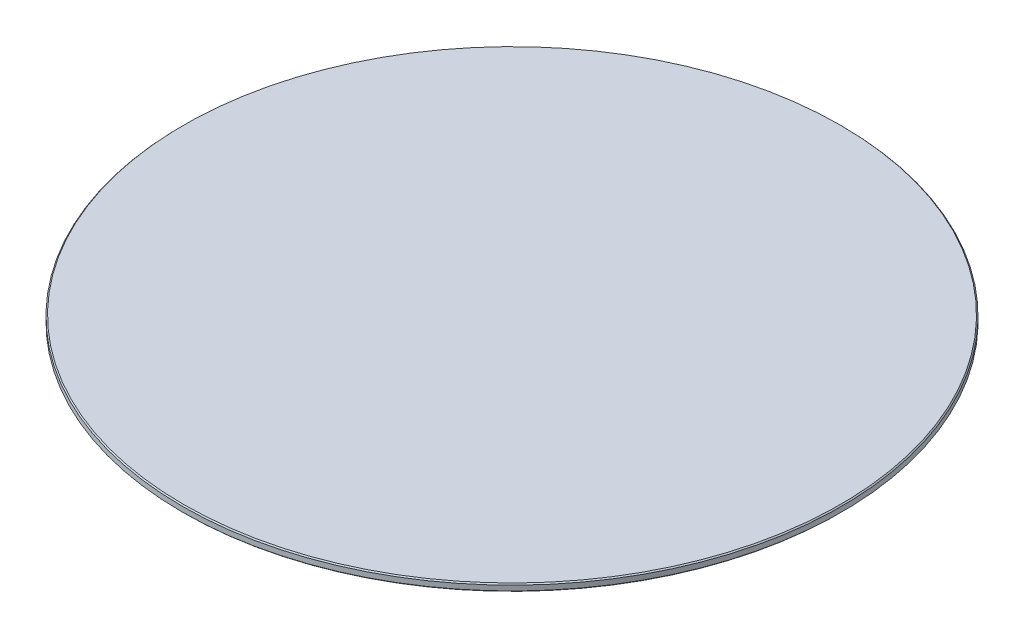
from build123d import *

# Parameters (mm, degrees)
SKETCH1_R           = 150
BOSS_EXTRUDE1_DEPTH = 3.3
CHAMFER1_SIZE       = 0.5


with BuildPart() as part:
    # Sketch1 → Boss-Extrude1 (new body)
    with BuildSketch(Plane(origin=(0, 0, 0), x_dir=(1, 0, 0), z_dir=(0, 1, 0))):
        with Locations(Location((0, 0, 0), (0, 0, 270))):
            Circle(SKETCH1_R)
    extrude(amount=BOSS_EXTRUDE1_DEPTH)

    # Chamfer1
    chamfer1_edges = [part.edges().sort_by_distance(p)[0] for p in [
        (0, 0, -150),
        (0, 3.3, -150),
    ]]
    chamfer(chamfer1_edges, length=CHAMFER1_SIZE)


solid = part.part
